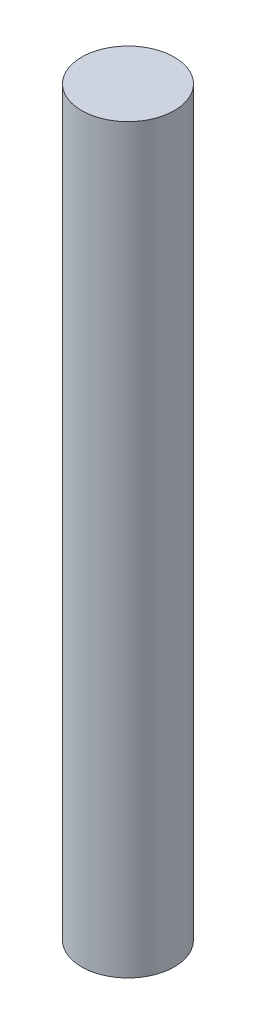
from build123d import *

# Parameters (mm, degrees)
ESQUISSE1_R        = 2.5
BOSS_EXTRU_1_DEPTH = 40


with BuildPart() as part:
    # Esquisse1 → Boss.-Extru.1 (new body)
    with BuildSketch(Plane(origin=(0, 0, 0), x_dir=(1, 0, 0), z_dir=(0, 1, 0))):
        with Locations(Location((0, 0, 0), (0, 0, 270))):
            Circle(ESQUISSE1_R)
    extrude(amount=BOSS_EXTRU_1_DEPTH)


solid = part.part
